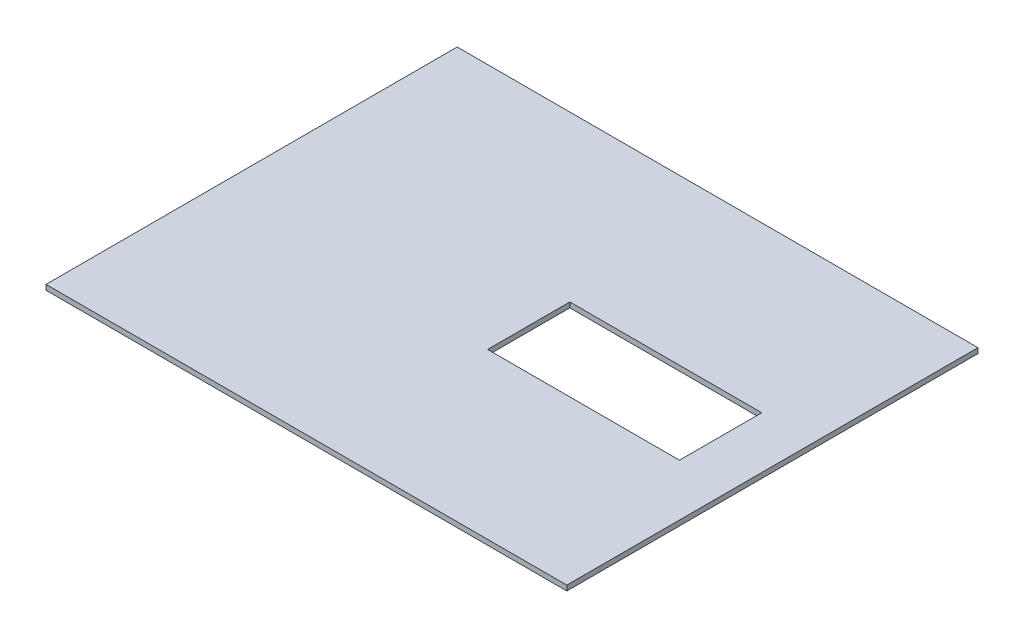
from build123d import *

# Parameters (mm, degrees)
SKETCH1_W           = 482.6
SKETCH1_H           = 381
BOSS_EXTRUDE1_DEPTH = 4.7625
SKETCH3_W           = 177.8
SKETCH3_H           = 76.2
CUT_EXTRUDE1_DEPTH  = 4.7625


with BuildPart() as part:
    # Sketch1 → Boss-Extrude1 (new body)
    with BuildSketch(Plane(origin=(0, 0, 0), x_dir=(1, 0, 0), z_dir=(0, 1, 0))):
        Rectangle(SKETCH1_W, SKETCH1_H)
    extrude(amount=BOSS_EXTRUDE1_DEPTH)

    # Sketch3 → Cut-Extrude1 (cut)
    with BuildSketch(Plane(origin=(0, 4.7625, 0), x_dir=(1, 0, 0), z_dir=(0, 1, 0))):
        with Locations((104.394, 0)):
            Rectangle(SKETCH3_W, SKETCH3_H)
    extrude(amount=-CUT_EXTRUDE1_DEPTH, mode=Mode.SUBTRACT)


solid = part.part
